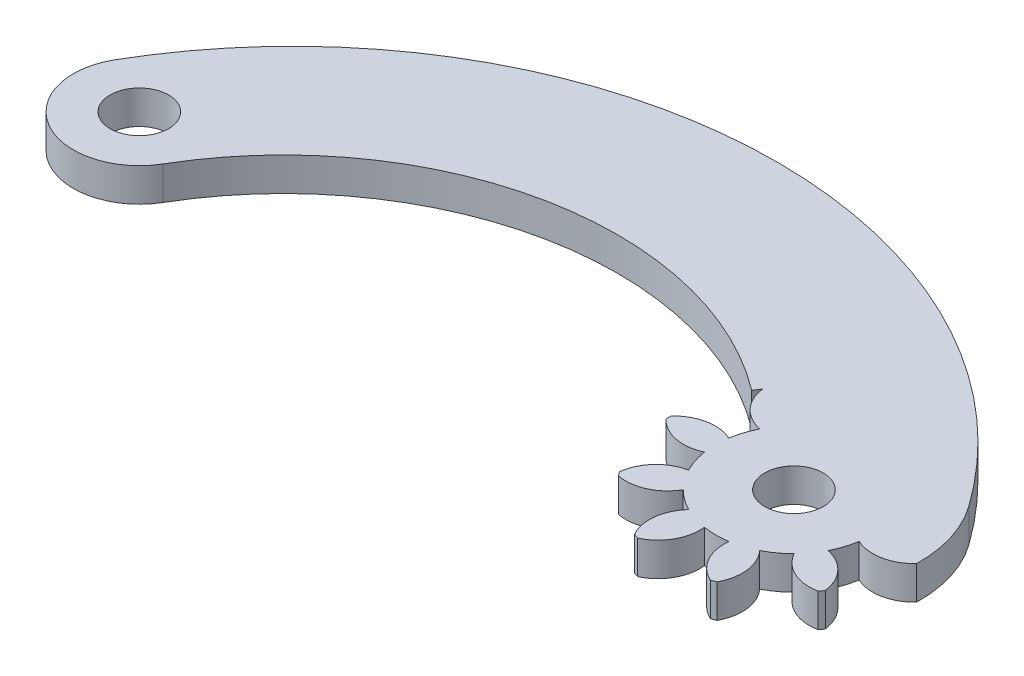
from build123d import *

# Parameters (mm, degrees)
SKETCH1_R           = 1.75
BOSS_EXTRUDE1_DEPTH = 1
CUT_EXTRUDE2_DEPTH  = 50.543327243


with BuildPart() as part:
    # Sketch1 → Boss-Extrude1 (new, symmetric)
    with BuildSketch(Plane(origin=(0, 0, 0), x_dir=(1, 0, 0), z_dir=(0, 1, 0))):
        with BuildLine():
            ThreePointArc((-3.421468999, 1.973841404), (-1.981409632, -3.417091727), (3.412697713, -1.988968154))
            ThreePointArc((3.412697713, -1.988968154), (16.766614489, 7.551271729), (32.763842766, 3.886308189))
            ThreePointArc((32.763842766, 3.886308189), (39.466098288, -7.49448014), (45.276159017, 4.366622946))
            ThreePointArc((45.276159017, 4.366622946), (20.274964763, 16.447403527), (-3.421468999, 1.973841404))
        make_face()
        with Locations(Location((0, 0, 0), (0, 0, 270))):
            Circle(SKETCH1_R, mode=Mode.SUBTRACT)
        with Locations(Location((39.178405, 0, 0), (0, 0, 270))):
            Circle(SKETCH1_R, mode=Mode.SUBTRACT)
    extrude(amount=BOSS_EXTRUDE1_DEPTH, both=True)

    # Sketch8 → Cut-Extrude2 (cut, through all)
    with BuildSketch(Plane(origin=(0, 1, 0), x_dir=(1, 0, 0), z_dir=(0, 1, 0))):
        with BuildLine():
            ThreePointArc((33.021583794, 4.282937385), (33.665616835, 2.886903504), (35.004794682, 2.131726803))
            ThreePointArc((35.004794682, 2.131726803), (34.721278636, 1.448208144), (34.548885748, 0.728583383))
            ThreePointArc((34.548885748, 0.728583383), (33.021586384, 0.904781587), (31.679984582, 0.153919576))
            ThreePointArc((31.679984582, 0.153919576), (32.045481128, 2.317627458), (33.021583794, 4.282937385))
        make_face()
        with BuildLine():
            ThreePointArc((31.679984582, -0.153919576), (33.021586384, -0.904781587), (34.548885748, -0.728583383))
            ThreePointArc((34.548885748, -0.728583383), (34.721278636, -1.448208144), (35.004794682, -2.131726803))
            ThreePointArc((35.004794682, -2.131726803), (33.665616835, -2.886903504), (33.021583794, -4.282937385))
            ThreePointArc((33.021583794, -4.282937385), (32.045481128, -2.317627458), (31.679984582, -0.153919576))
        make_face()
        with BuildLine():
            ThreePointArc((33.202527108, -4.53198449), (34.729251382, -4.350870864), (35.861295817, -3.31059948))
            ThreePointArc((35.861295817, -3.31059948), (36.423749415, -3.791458144), (37.054880901, -4.177789805))
            ThreePointArc((37.054880901, -4.177789805), (36.415344992, -5.575889578), (36.714879444, -7.083857836))
            ThreePointArc((36.714879444, -7.083857836), (34.770015608, -6.067627458), (33.202527108, -4.53198449))
        make_face()
        with BuildLine():
            ThreePointArc((37.007651875, -7.178985365), (38.13634184, -6.135075351), (38.440728849, -4.628079099))
            ThreePointArc((38.440728849, -4.628079099), (39.178405, -4.6865), (39.916081151, -4.628079099))
            ThreePointArc((39.916081151, -4.628079099), (40.22046816, -6.135075351), (41.349158125, -7.178985365))
            ThreePointArc((41.349158125, -7.178985365), (39.178405, -7.5), (37.007651875, -7.178985365))
        make_face()
        with BuildLine():
            ThreePointArc((41.641930556, -7.083857836), (41.941465008, -5.575889578), (41.301929099, -4.177789805))
            ThreePointArc((41.301929099, -4.177789805), (41.933060585, -3.791458144), (42.495514183, -3.31059948))
            ThreePointArc((42.495514183, -3.31059948), (43.627558618, -4.350870864), (45.154282892, -4.53198449))
            ThreePointArc((45.154282892, -4.53198449), (43.586794392, -6.067627458), (41.641930556, -7.083857836))
        make_face()
        with BuildLine():
            ThreePointArc((45.335226206, -4.282937385), (44.691193165, -2.886903504), (43.352015318, -2.131726803))
            ThreePointArc((43.352015318, -2.131726803), (43.635531364, -1.448208144), (43.807924252, -0.728583383))
            ThreePointArc((43.807924252, -0.728583383), (45.335223616, -0.904781587), (46.676825418, -0.153919576))
            ThreePointArc((46.676825418, -0.153919576), (46.311328872, -2.317627458), (45.335226206, -4.282937385))
        make_face()
    extrude(amount=-CUT_EXTRUDE2_DEPTH, mode=Mode.SUBTRACT)


solid = part.part
